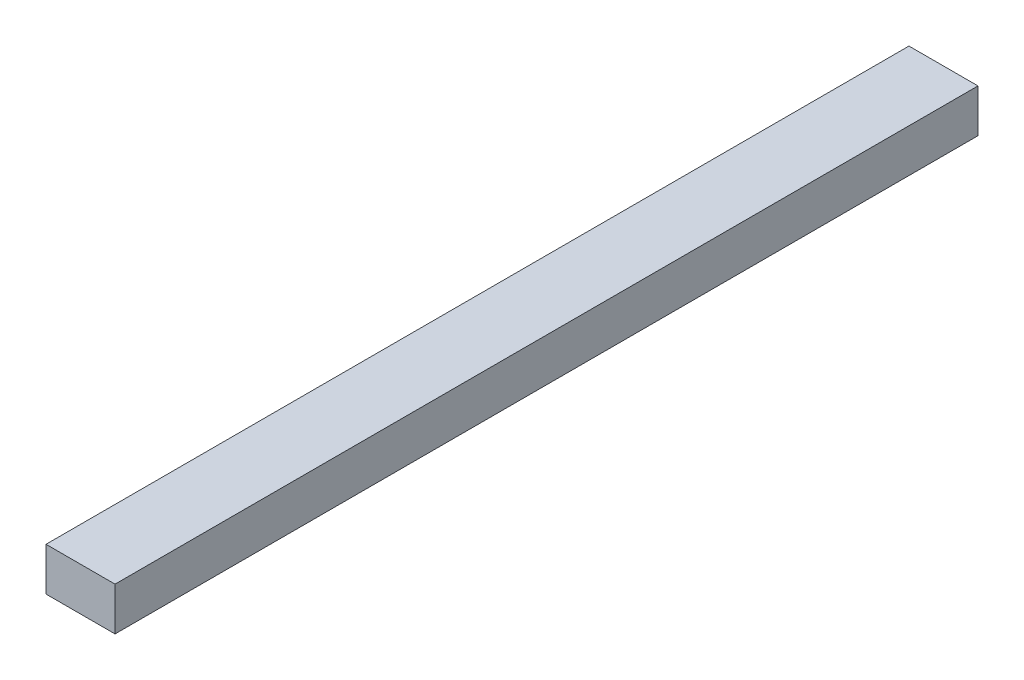
from build123d import *

# Parameters (mm, degrees)
ESQUISSE1_W        = 40
ESQUISSE1_H        = 25
BOSS_EXTRU_1_DEPTH = 500


with BuildPart() as part:
    # Esquisse1 → Boss.-Extru.1 (new body)
    with BuildSketch(Plane.XY):
        with Locations((20, 12.5)):
            Rectangle(ESQUISSE1_W, ESQUISSE1_H)
    extrude(amount=BOSS_EXTRU_1_DEPTH)


solid = part.part
